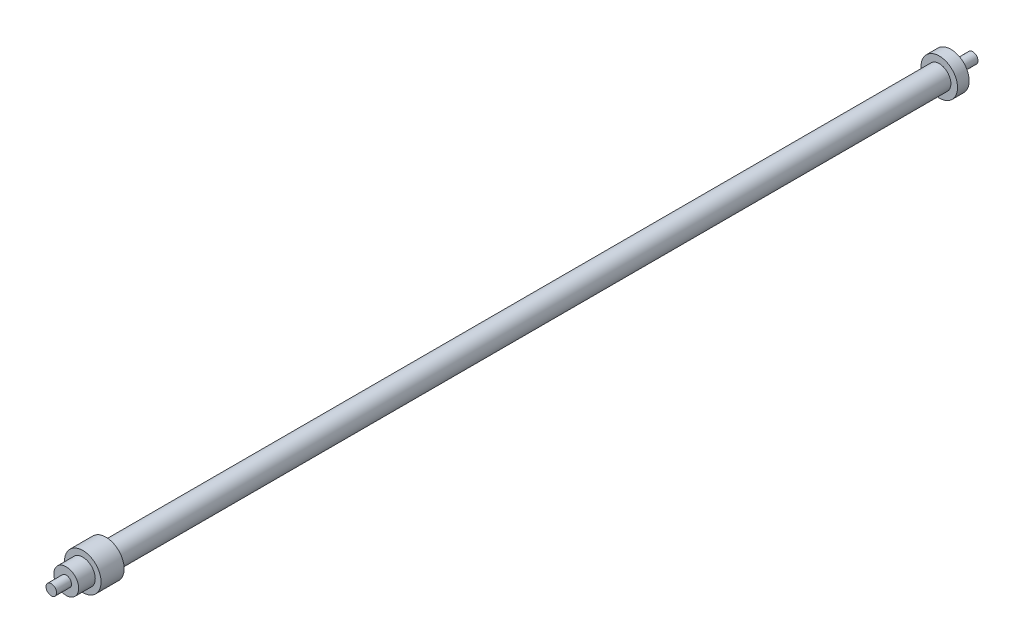
from build123d import *


with BuildPart() as part:
    # Sketch6 → Revolve1 (revolve)
    with BuildSketch(Plane(origin=(0, 0, 0), x_dir=(0, 0, -1), z_dir=(1, 0, 0)), mode=Mode.PRIVATE) as revolve1_sk:
        Polygon((-139.865098059, 32.5), (415.134901941, 32.5), (415.134901941, 35.675), (405.034901941, 35.675), (405.034901941, 36.5), (401.984901941, 36.5), (401.984901941, 43.5), (394.984901941, 43.5), (394.984901941, 39.5), (-106.955098059, 39.5), (-106.955098059, 43.5), (-120.865098059, 43.5), (-120.865098059, 40), (-130.865098059, 40), (-130.865098059, 35.675), (-139.865098059, 35.675), align=None)
    revolve(revolve1_sk.sketch.rotate(Axis((0, 32.5, 139.865098059), (0, 0, -1)), 90), axis=Axis((0, 32.5, 139.865098059), (0, 0, -1)))


solid = part.part
